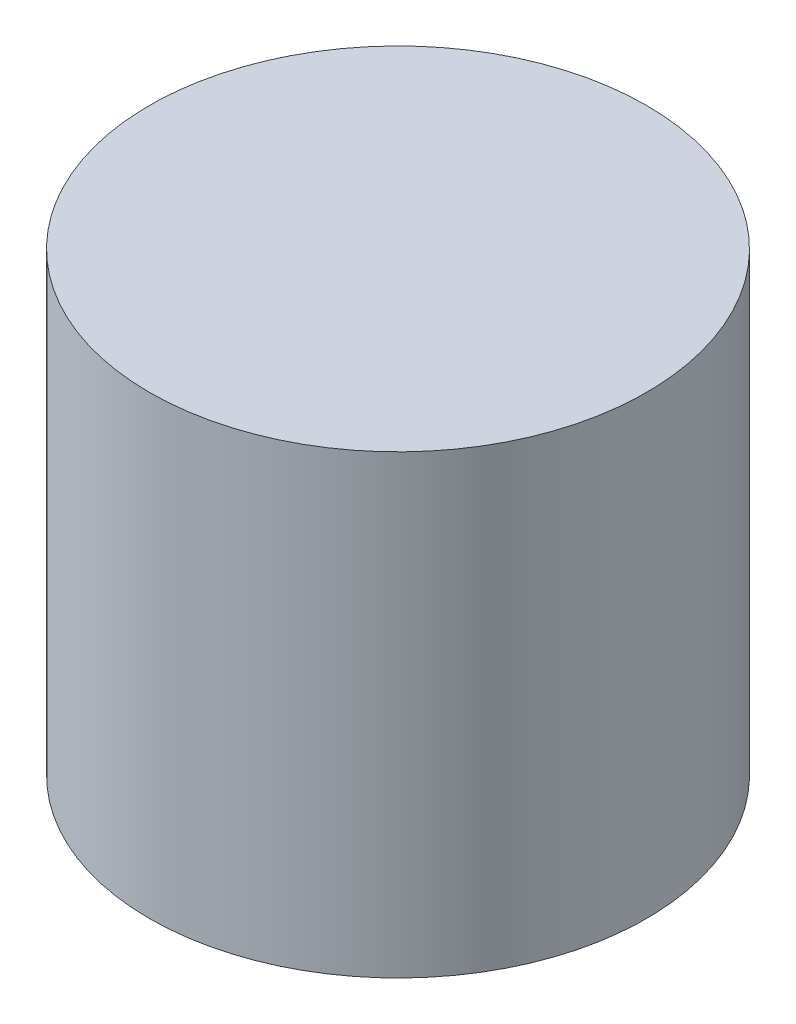
from build123d import *

# Parameters (mm, degrees)
SKETCH1_R           = 6
BOSS_EXTRUDE1_DEPTH = 11


with BuildPart() as part:
    # Sketch1 → Boss-Extrude1 (new body)
    with BuildSketch(Plane(origin=(0, 0, 0), x_dir=(1, 0, 0), z_dir=(0, 1, 0))):
        with Locations(Location((0, 0, 0), (0, 0, 270))):
            Circle(SKETCH1_R)
    extrude(amount=BOSS_EXTRUDE1_DEPTH)


solid = part.part
